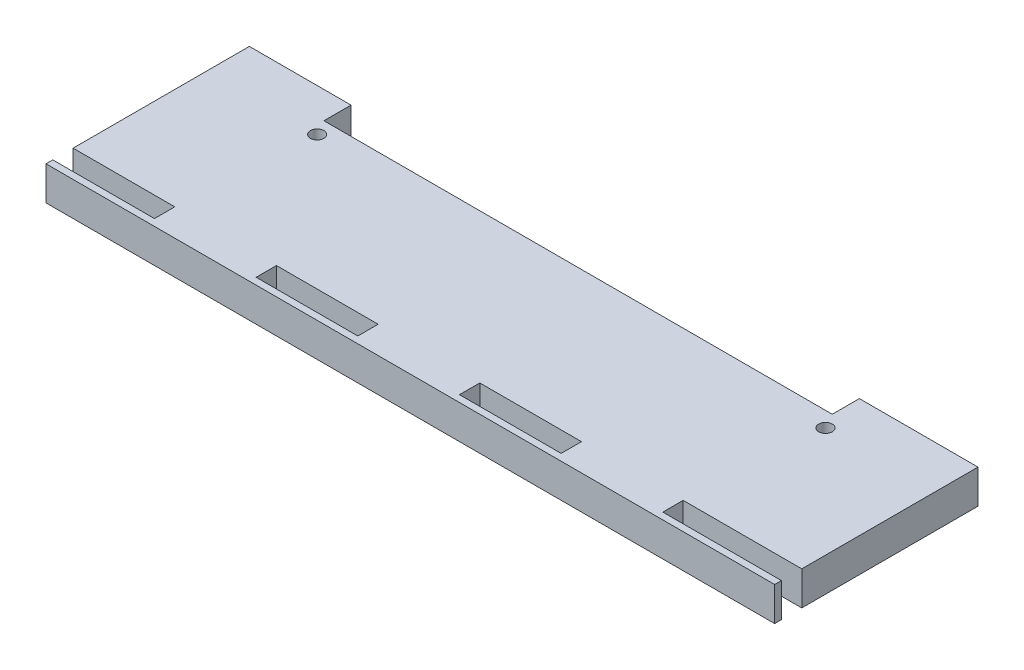
from build123d import *

# Parameters (mm, degrees)
SKETCH_1_W      = 30
SKETCH_1_H      = 6
SKETCH_1_R      = 2
EXTRUDE_1_DEPTH = 10


with BuildPart() as part:
    # Эскиз1 → Бобышка-Вытянуть1 (new body)
    with BuildSketch(Plane(origin=(0, 0, 0), x_dir=(1, 0, 0), z_dir=(0, 1, 0))):
        Polygon((-107.5, 25), (-107.5, -25), (-107.5, -27), (-77.5, -27), (-77.5, -33), (-107.5, -33), (-107.5, -35), (107.5, -35), (107.5, -33), (72.5, -33), (72.5, -27), (107.5, -27), (107.5, -25), (107.5, 25), (72.5, 25), (72.5, 17), (-77.5, 17), (-77.5, 25), align=None)
        with Locations((-32.5, -30)):
            Rectangle(SKETCH_1_W, SKETCH_1_H, mode=Mode.SUBTRACT)
        with Locations((27.5, -30)):
            Rectangle(SKETCH_1_W, SKETCH_1_H, mode=Mode.SUBTRACT)
        with Locations((-75, 12.5)):
            Circle(SKETCH_1_R, mode=Mode.SUBTRACT)
        with Locations((75, 12.5)):
            Circle(SKETCH_1_R, mode=Mode.SUBTRACT)
    extrude(amount=EXTRUDE_1_DEPTH)


solid = part.part
